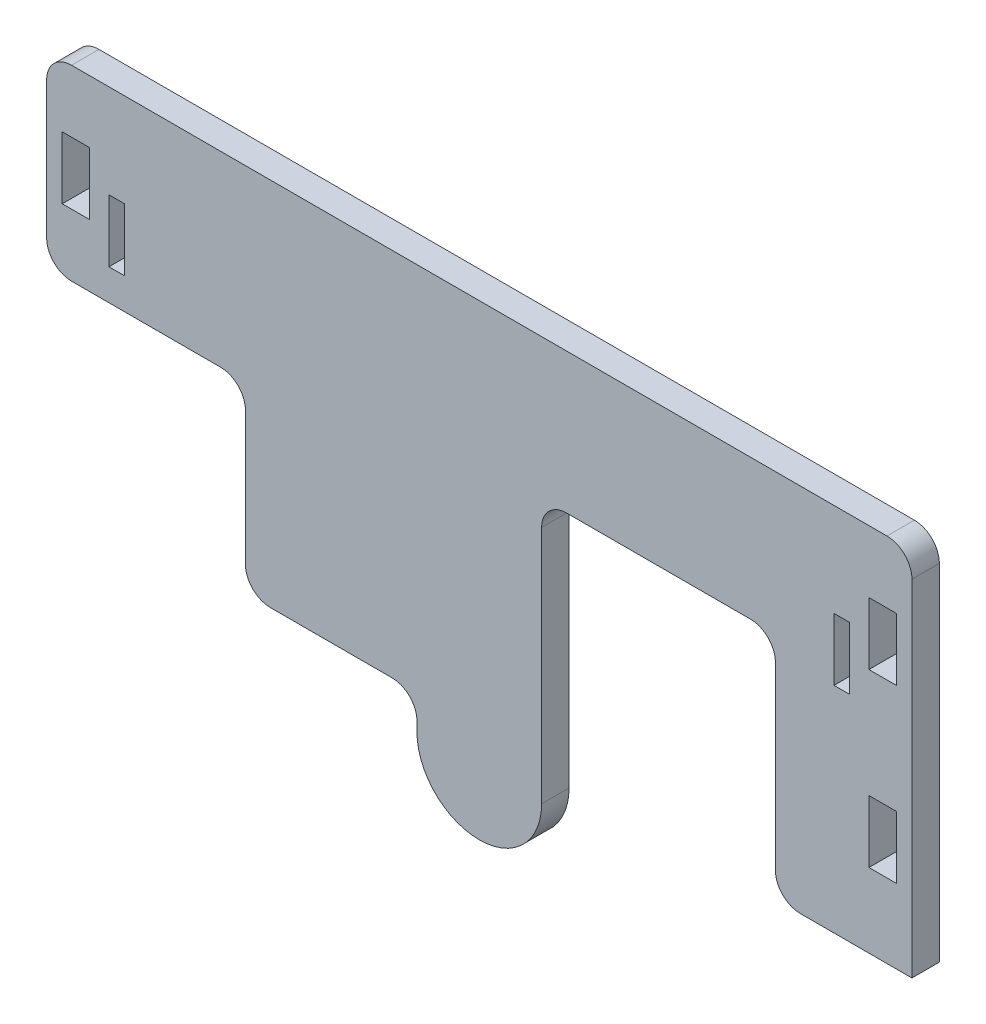
from build123d import *

# Parameters (mm, degrees)
BOSS_EXTRUDE1_DEPTH = 2.794
SKETCH3_W           = 2.794
SKETCH3_H           = 6.35
SKETCH3_W_2         = 1.5875
CUT_EXTRUDE1_DEPTH  = 78.110446656
FILLET1_R           = 2.54


with BuildPart() as part:
    # Sketch1 → Boss-Extrude1 (new body)
    with BuildSketch(Plane.XY):
        with BuildLine():
            Line((69.475359958, -4.3815), (69.475359958, 33.3375))
            Line((69.475359958, 33.3375), (-18.662640042, 33.3375))
            Line((-18.662640042, 33.3375), (-18.662640042, 14.2875))
            Line((-18.662640042, 14.2875), (1.5875, 14.2875))
            Line((1.5875, 14.2875), (1.5875, -4.3815))
            Line((1.5875, -4.3815), (19.056359958, -4.3815))
            Line((19.056359958, -4.3815), (19.056359958, -7.8778))
            ThreePointArc((19.056359958, -7.8778), (25.406359958, -14.2278), (31.756359958, -7.8778))
            Line((31.756359958, -7.8778), (31.756359958, 19.05))
            Line((31.756359958, 19.05), (55.568859958, 19.05))
            Line((55.568859958, 19.05), (55.568859958, -4.3815))
            Line((55.568859958, -4.3815), (69.475359958, -4.3815))
        make_face()
    extrude(amount=BOSS_EXTRUDE1_DEPTH)

    # Sketch3 → Cut-Extrude1 (cut, through all)
    with BuildSketch(Plane.XY.offset(2.794)):
        with Locations((-15.678140042, 23.8125)):
            Rectangle(SKETCH3_W, SKETCH3_H)
        with Locations((66.490859958, 23.8125)):
            Rectangle(SKETCH3_W, SKETCH3_H)
        with Locations((66.490859958, 6.35)):
            Rectangle(SKETCH3_W, SKETCH3_H)
        with Locations((-11.518890042, 20.6375)):
            Rectangle(SKETCH3_W_2, SKETCH3_H)
        with Locations((62.331609958, 20.6375)):
            Rectangle(SKETCH3_W_2, SKETCH3_H)
    extrude(amount=-CUT_EXTRUDE1_DEPTH, mode=Mode.SUBTRACT)

    # Fillet1
    fillet1_edges = [part.edges().sort_by_distance(p)[0] for p in [
        (1.5875, 14.2875, 1.397),
        (1.5875, -4.3815, 1.397),
        (55.568859958, -4.3815, 1.397),
        (31.756359958, 19.05, 1.397),
        (55.568859958, 19.05, 1.397),
        (-18.662640042, 33.3375, 1.397),
        (69.475359958, 33.3375, 1.397),
        (-18.662640042, 14.2875, 1.397),
        (19.056359958, -4.3815, 1.397),
    ]]
    fillet(fillet1_edges, radius=FILLET1_R)


solid = part.part
